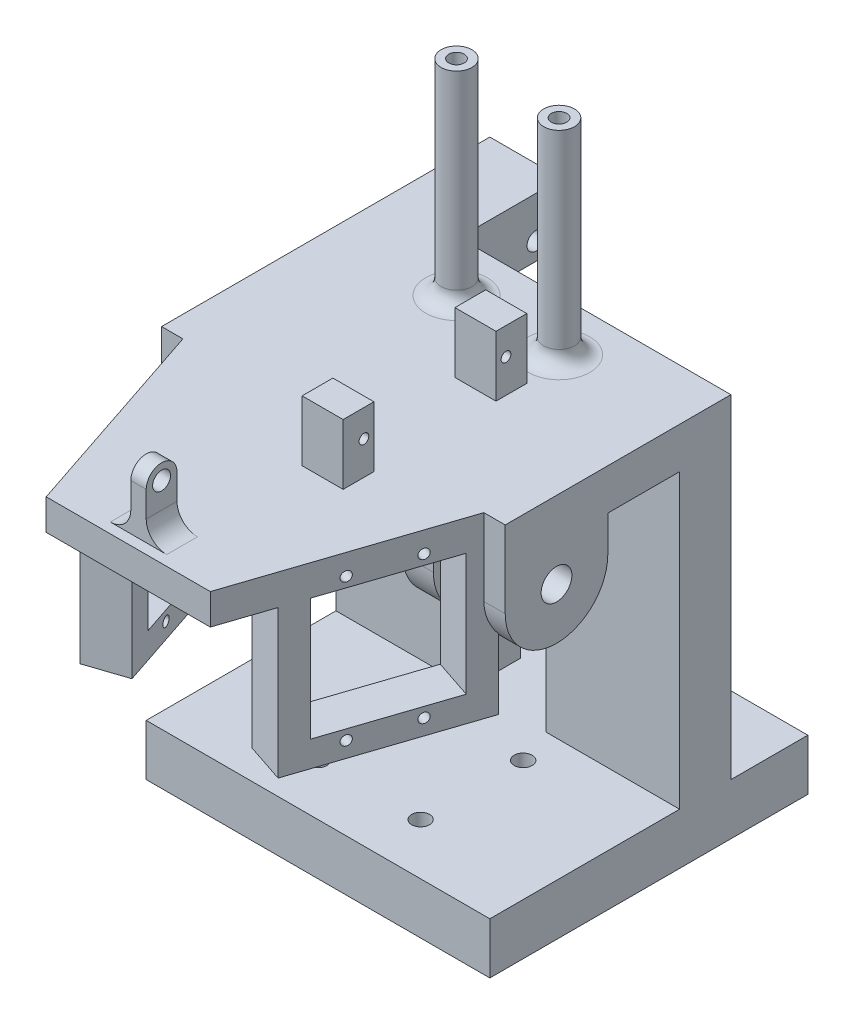
from build123d import *

# Parameters (mm, degrees)
SKETCH_1_W             = 67
SKETCH_1_H             = 62
EXTRUDE_1_DEPTH        = 10
SKETCH_3_W             = 14
SKETCH_3_H             = 20
EXTRUDE_2_DEPTH        = 12.5
SKETCH_4_W             = 10
SKETCH_4_H             = 65
EXTRUDE_3_DEPTH        = 67
SKETCH_5_W             = 67
SKETCH_5_H             = 44
EXTRUDE_4_DEPTH        = 8
EXTRUDE_5_DEPTH        = 20
CUT_EXTRUDE_START      = -6
CUT_EXTRUDE_1_DEPTH    = 8
EXTRUDE_6_DEPTH        = 6
SKETCH_9_R             = 3
CUT_EXTRUDE_2_DEPTH    = 23
SKETCH_10_W            = 24
SKETCH_10_H            = 23.8
EXTRUDE_7_DEPTH        = 8
SKETCH_12_W            = 14
SKETCH_12_H            = 20
EXTRUDE_8_DEPTH        = 11.5
SKETCH_13_R            = 0.95
CUT_EXTRUDE_4_DEPTH    = 8
SKETCH_14_W            = 8
SKETCH_14_H            = 6
EXTRUDE_9_DEPTH        = 11.8
SKETCH_15_R            = 0.95
CUT_EXTRUDE_5_DEPTH    = 11.8
SKETCH_16_W            = 3
SKETCH_16_H            = 6
EXTRUDE_10_DEPTH       = 12
FILLET_1_RADIUS        = 3
FILLET_1_LENGTH        = 3
SKETCH_17_R            = 1.75
CUT_EXTRUDE_6_DEPTH    = 7
SKETCH_18_R            = 3
EXTRUDE_11_DEPTH       = 40
FILLET_2_R             = 3
FILLET_2_OF_MIRROR_1_R = 3
SKETCH_20_R            = 1.75
CUT_EXTRUDE_7_DEPTH    = 35
SKETCH_21_W            = 15
SKETCH_21_H            = 55
CUT_EXTRUDE_8_DEPTH    = 35
SKETCH_24_R            = 1.75
CUT_EXTRUDE_11_DEPTH   = 18
SKETCH_25_R            = 1.5
CUT_EXTRUDE_12_DEPTH   = 10
FILLET_3_R             = 4
SKETCH_26_W            = 9.8
SKETCH_26_H            = 3.6
EXTRUDE_12_DEPTH       = 1
SKETCH_27_R            = 1.4
CUT_EXTRUDE_13_DEPTH   = 4


with BuildPart() as part:
    # 草图1 → 凸台-拉伸1 (new body)
    with BuildSketch(Plane(origin=(0, 0, 0), x_dir=(1, 0, 0), z_dir=(0, 1, 0))):
        Rectangle(SKETCH_1_W, SKETCH_1_H)
    extrude(amount=EXTRUDE_1_DEPTH)

    # 草图3 → 凸台-拉伸2 (add)
    with BuildSketch(Plane(origin=(0, 10, 0), x_dir=(1, 0, 0), z_dir=(0, 1, 0))):
        with Locations((-26.5, 26)):
            Rectangle(SKETCH_3_W, SKETCH_3_H)
    extrude(amount=EXTRUDE_2_DEPTH)

    # 草图4 → 凸台-拉伸3 (add)
    with BuildSketch(Plane.ZY.offset(33.5)):
        with Locations((-11, 42.5)):
            Rectangle(SKETCH_4_W, SKETCH_4_H)
    extrude(amount=-EXTRUDE_3_DEPTH)

    # 草图5 → 凸台-拉伸4 (add)
    with BuildSketch(Plane(origin=(0, 75, 0), x_dir=(1, 0, 0), z_dir=(0, 1, 0))):
        with Locations((0, -6)):
            Rectangle(SKETCH_5_W, SKETCH_5_H)
    extrude(amount=-EXTRUDE_4_DEPTH)

    # 草图6 → 凸台-拉伸5 (add)
    with BuildSketch(Plane(origin=(33.5, 0, 0), x_dir=(0, 0, -1), z_dir=(1, 0, 0))):
        with BuildLine():
            Line((-28, 60), (-28, 67))
            Line((-28, 67), (-8, 67))
            Line((-8, 67), (-8, 60))
            ThreePointArc((-8, 60), (-18, 50), (-28, 60))
        make_face()
    extrude_5 = extrude(amount=-EXTRUDE_5_DEPTH)

    # 草图7 → 切除-拉伸1 (cut)
    with BuildSketch(Plane(origin=(33.5, 0, 0), x_dir=(0, 0, -1), z_dir=(1, 0, 0)).offset(CUT_EXTRUDE_START)):
        with BuildLine():
            Line((-28, 60), (-28, 70.000230089))
            Line((-28, 70.000230089), (-8, 70.000230089))
            Line((-8, 70.000230089), (-8, 60))
            ThreePointArc((-8, 60), (-18, 50), (-28, 60))
        make_face()
    cut_extrude_1 = extrude(amount=-CUT_EXTRUDE_1_DEPTH, mode=Mode.SUBTRACT)

    # 草图8 → 凸台-拉伸6 (add)
    with BuildSketch(Plane(origin=(0, 75, 0), x_dir=(1, 0, 0), z_dir=(0, 1, 0))):
        Polygon((0, -68), (16, -68), (29.337683895, -28), (0, -28), align=None)
    extrude_6 = extrude(amount=-EXTRUDE_6_DEPTH)

    # 草图9 → 切除-拉伸2 (cut)
    with BuildSketch(Plane(origin=(33.5, 0, 0), x_dir=(0, 0, -1), z_dir=(1, 0, 0))):
        with Locations((-18, 60)):
            Circle(SKETCH_9_R)
    cut_extrude_2 = extrude(amount=-CUT_EXTRUDE_2_DEPTH, mode=Mode.SUBTRACT)

    # 草图10 → 凸台-拉伸7 (add)
    with BuildSketch(Plane(origin=(34.804384709, 0, 11.605247035), x_dir=(0.3163206258352512, 0, -0.9486523397278874), z_dir=(0.9486523397278874, 0, 0.3163206258352512))):
        Polygon((-44, 75), (-15, 75), (-15, 40.2), (-43, 40.2), (-49, 40.2), (-49, 75), align=None)
        with Locations((-32, 57.1)):
            Rectangle(SKETCH_10_W, SKETCH_10_H, mode=Mode.SUBTRACT)
    extrude_7 = extrude(amount=-EXTRUDE_7_DEPTH)

    # 草图12 → 凸台-拉伸8 (add)
    with BuildSketch(Plane(origin=(0, 75, 0), x_dir=(1, 0, 0), z_dir=(0, 1, 0))):
        with Locations((-26.5, 26)):
            Rectangle(SKETCH_12_W, SKETCH_12_H)
    extrude(amount=-EXTRUDE_8_DEPTH)

    # 草图13 → 切除-拉伸4 (cut)
    with BuildSketch(Plane(origin=(27.215165992, 0, 9.074682029), x_dir=(-0.3163206258352515, 0, 0.9486523397278873), z_dir=(-0.9486523397278873, 0, -0.3163206258352515))):
        with Locations((38.5, 70.95)):
            Circle(SKETCH_13_R)
        with Locations((26.5, 70.95)):
            Circle(SKETCH_13_R)
        with Locations((26.5, 43.25)):
            Circle(SKETCH_13_R)
        with Locations((38.5, 43.25)):
            Circle(SKETCH_13_R)
    cut_extrude_4 = extrude(amount=-CUT_EXTRUDE_4_DEPTH, mode=Mode.SUBTRACT)

    # 草图14 → 凸台-拉伸9 (add)
    with BuildSketch(Plane(origin=(0, 75, 0), x_dir=(1, 0, 0), z_dir=(0, 1, 0))):
        with Locations((7.7, -5)):
            Rectangle(SKETCH_14_W, SKETCH_14_H)
        with Locations((7.7, -34.8)):
            Rectangle(SKETCH_14_W, SKETCH_14_H)
    extrude(amount=EXTRUDE_9_DEPTH)

    # 草图15 → 切除-拉伸5 (cut)
    with BuildSketch(Plane.ZY.offset(-3.7)):
        with Locations((33.75, 81.5)):
            Circle(SKETCH_15_R)
        with Locations((6.05, 81.5)):
            Circle(SKETCH_15_R)
    extrude(amount=-CUT_EXTRUDE_5_DEPTH, mode=Mode.SUBTRACT)

    # 草图16 → 凸台-拉伸10 (add)
    with BuildSketch(Plane(origin=(0, 75, 0), x_dir=(1, 0, 0), z_dir=(0, 1, 0))):
        with Locations((0, -63)):
            Rectangle(SKETCH_16_W, SKETCH_16_H)
    extrude(amount=EXTRUDE_10_DEPTH)

    # 圆角1: full round fillet: the end face becomes a half cylinder, R = half its width
    fillet_1_face = Plane((0, 87, 63), x_dir=(1, 0, 0), z_dir=(0, 1, 0))  # on the end face: x along it, z out of the body
    fillet_1_slab = fillet_1_face.offset(-FILLET_1_RADIUS / 2) * Box(FILLET_1_LENGTH, 2 * FILLET_1_RADIUS, FILLET_1_RADIUS, mode=Mode.PRIVATE)  # the body's end, R deep
    fillet_1_round = Plane((0, 84, 63), x_dir=(0, 1, 0), z_dir=(1, 0, 0)) * Cylinder(FILLET_1_RADIUS, FILLET_1_LENGTH, mode=Mode.PRIVATE)  # its axis R under the face
    add(fillet_1_slab - fillet_1_round, mode=Mode.SUBTRACT)

    # 草图17 → 切除-拉伸6 (cut)
    with BuildSketch(Plane.ZY.offset(1.5)):
        with Locations((63, 84)):
            Circle(SKETCH_17_R)
    extrude(amount=-CUT_EXTRUDE_6_DEPTH, mode=Mode.SUBTRACT)

    # 草图18 → 凸台-拉伸11 (add)
    with BuildSketch(Plane(origin=(0, 75, 0), x_dir=(1, 0, 0), z_dir=(0, 1, 0))):
        with Locations(Location((10, 6, 0), (0, 0, 270))):
            Circle(SKETCH_18_R)
    extrude_11 = extrude(amount=EXTRUDE_11_DEPTH)

    # 圆角2
    fillet_2_edges = [part.edges().sort_by_distance(p)[0] for p in [
        (10, 75, -9),
    ]]
    fillet(fillet_2_edges, radius=FILLET_2_R)

    # 镜向1: 凸台-拉伸5, 切除-拉伸1, 凸台-拉伸6, 切除-拉伸2, 凸台-拉伸7, 切除-拉伸4, 凸台-拉伸11 across plane
    add(extrude_5.mirror(Plane(origin=(0, 0, 0), x_dir=(0, 0, 1), z_dir=(1, 0, 0))))
    add(cut_extrude_1.mirror(Plane(origin=(0, 0, 0), x_dir=(0, 0, 1), z_dir=(1, 0, 0))), mode=Mode.SUBTRACT)
    add(extrude_6.mirror(Plane(origin=(0, 0, 0), x_dir=(0, 0, 1), z_dir=(1, 0, 0))))
    add(cut_extrude_2.mirror(Plane(origin=(0, 0, 0), x_dir=(0, 0, 1), z_dir=(1, 0, 0))), mode=Mode.SUBTRACT)
    add(extrude_7.mirror(Plane(origin=(0, 0, 0), x_dir=(0, 0, 1), z_dir=(1, 0, 0))))
    add(cut_extrude_4.mirror(Plane(origin=(0, 0, 0), x_dir=(0, 0, 1), z_dir=(1, 0, 0))), mode=Mode.SUBTRACT)
    add(extrude_11.mirror(Plane(origin=(0, 0, 0), x_dir=(0, 0, 1), z_dir=(1, 0, 0))))

    # 圆角2 of 镜向1
    fillet_2_of_mirror_1_edges = [part.edges().sort_by_distance(p)[0] for p in [
        (-10, 75, -9),
    ]]
    fillet(fillet_2_of_mirror_1_edges, radius=FILLET_2_OF_MIRROR_1_R)

    # 草图20 → 切除-拉伸7 (cut)
    with BuildSketch(Plane.ZY.offset(33.5)):
        with Locations((-31, 67)):
            Circle(SKETCH_20_R)
        with Locations((-21, 67)):
            Circle(SKETCH_20_R)
        with Locations((-31, 19)):
            Circle(SKETCH_20_R)
        with Locations((-21, 19)):
            Circle(SKETCH_20_R)
    extrude(amount=-CUT_EXTRUDE_7_DEPTH, mode=Mode.SUBTRACT)

    # 草图21 → 切除-拉伸8 (cut)
    with BuildSketch(Plane(origin=(0, 0, -16), x_dir=(-1, 0, 0), z_dir=(0, 0, -1))):
        with Locations((0, 37.5)):
            Rectangle(SKETCH_21_W, SKETCH_21_H)
    extrude(amount=-CUT_EXTRUDE_8_DEPTH, mode=Mode.SUBTRACT)

    # 草图24 → 切除-拉伸11 (cut)
    with BuildSketch(Plane(origin=(0, 10, 0), x_dir=(1, 0, 0), z_dir=(0, 1, 0))):
        with Locations(Location((-10, -21, 0), (0, 0, 270))):
            Circle(SKETCH_24_R)
        with Locations(Location((10, -21, 0), (0, 0, 270))):
            Circle(SKETCH_24_R)
        with Locations(Location((-10, -1, 0), (0, 0, 270))):
            Circle(SKETCH_24_R)
        with Locations(Location((10, -1, 0), (0, 0, 270))):
            Circle(SKETCH_24_R)
    extrude(amount=-CUT_EXTRUDE_11_DEPTH, mode=Mode.SUBTRACT)

    # 草图25 → 切除-拉伸12 (cut)
    with BuildSketch(Plane(origin=(0, 115, 0), x_dir=(1, 0, 0), z_dir=(0, 1, 0))):
        with Locations(Location((10, 6, 0), (0, 0, 270))):
            Circle(SKETCH_25_R)
        with Locations(Location((-10, 6, 0), (0, 0, 270))):
            Circle(SKETCH_25_R)
    extrude(amount=-CUT_EXTRUDE_12_DEPTH, mode=Mode.SUBTRACT)

    # 圆角3
    fillet_3_edges = [part.edges().sort_by_distance(p)[0] for p in [
        (-1.5, 75, 63),
        (1.5, 75, 63),
    ]]
    fillet(fillet_3_edges, radius=FILLET_3_R)

    # 草图26 → 凸台-拉伸12 (add)
    with BuildSketch(Plane.XZ.offset(-69)):
        with Locations((0, 62.02)):
            Rectangle(SKETCH_26_W, SKETCH_26_H)
    extrude(amount=EXTRUDE_12_DEPTH)

    # 草图27 → 切除-拉伸13 (cut)
    with BuildSketch(Plane.XZ.offset(-68)):
        with Locations(Location((0, 62, 0), (0, 0, 270))):
            Circle(SKETCH_27_R)
    extrude(amount=-CUT_EXTRUDE_13_DEPTH, mode=Mode.SUBTRACT)


solid = part.part
